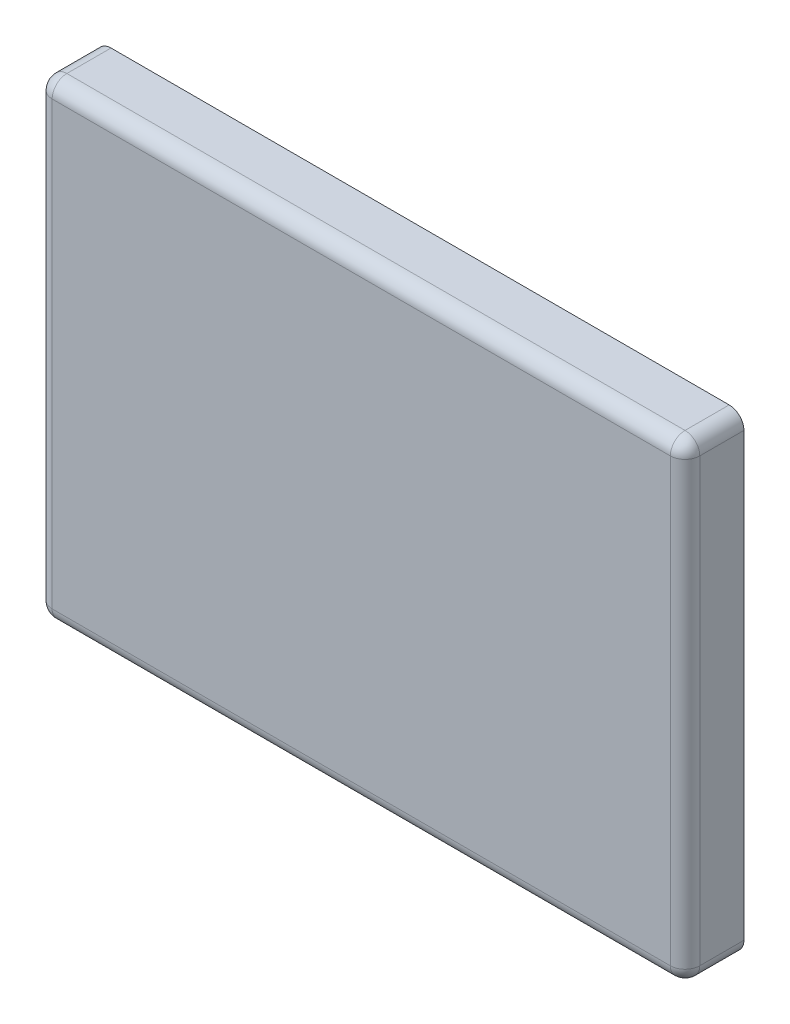
from build123d import *

# Parameters (mm, degrees)
SKETCH_1_W          = 440
SKETCH_1_H          = 320
EXTRUDE_1_DEPTH     = 40
FILLET_1_R          = 10
SKETCH_3_W          = 360
SKETCH_3_H          = 240
EXTRUDE_2_DEPTH     = 20
SKETCH_4_R          = 5
CUT_EXTRUDE_1_DEPTH = 10


with BuildPart() as part:
    # 草图1 → 凸台-拉伸1 (new body)
    with BuildSketch(Plane.XY):
        with Locations((220, -160)):
            Rectangle(SKETCH_1_W, SKETCH_1_H)
    extrude(amount=EXTRUDE_1_DEPTH)

    # 圆角1
    fillet_1_edges = [part.edges().sort_by_distance(p)[0] for p in [
        (440, -160, 40),
        (220, 0, 40),
        (0, -160, 40),
        (0, 0, 20),
        (440, 0, 20),
        (440, -320, 20),
        (0, -320, 20),
        (220, -320, 40),
    ]]
    fillet(fillet_1_edges, radius=FILLET_1_R)

    # 草图3 → 凸台-拉伸2 (add)
    with BuildSketch(Plane(origin=(0, 0, 0), x_dir=(-1, 0, 0), z_dir=(0, 0, -1))):
        with Locations((-220, -160)):
            Rectangle(SKETCH_3_W, SKETCH_3_H)
    extrude(amount=EXTRUDE_2_DEPTH)

    # 草图4 → 切除-拉伸1 (cut)
    with BuildSketch(Plane(origin=(0, 0, 0), x_dir=(-1, 0, 0), z_dir=(0, 0, -1))):
        with Locations((-430, -60)):
            Circle(SKETCH_4_R)
        with Locations((-430, -260)):
            Circle(SKETCH_4_R)
    extrude(amount=-CUT_EXTRUDE_1_DEPTH, mode=Mode.SUBTRACT)


solid = part.part
